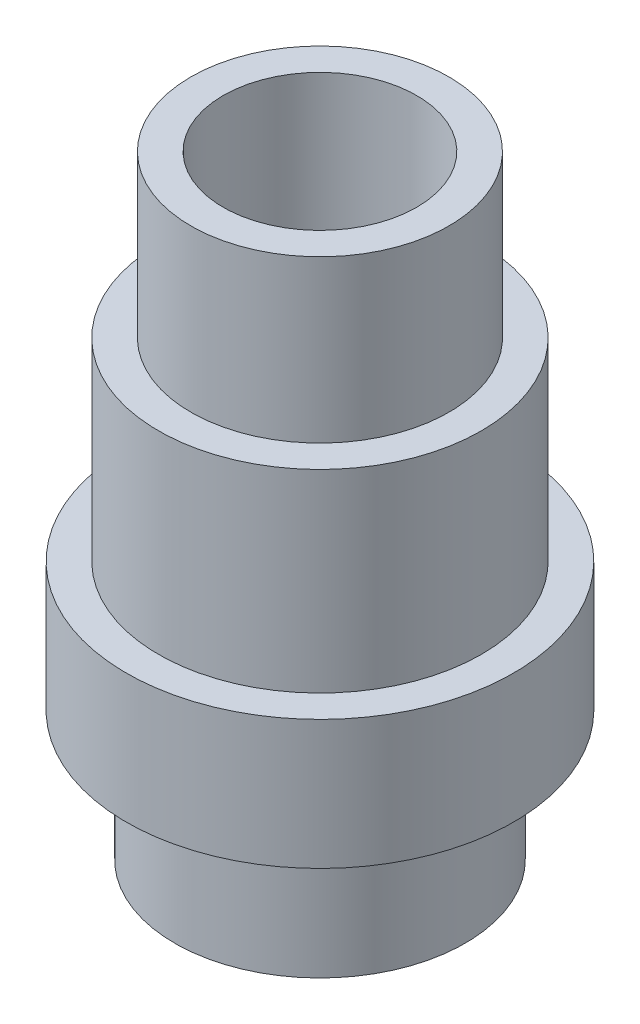
from build123d import *


with BuildPart() as part:
    # Sketch2 → Revolve1 (revolve)
    with BuildSketch(Plane.XY):
        Polygon((-15, -50.713457077), (-15, 44.286542923), (-20, 44.286542923), (-20, 19.286542923), (-25, 19.286542923), (-25, -10.713457077), (-30, -10.713457077), (-30, -30.713457077), (-22.5, -30.713457077), (-22.5, -50.713457077), align=None)
    revolve(axis=Axis((0, 108.996519722, 0), (0, -1, 0)))


solid = part.part
